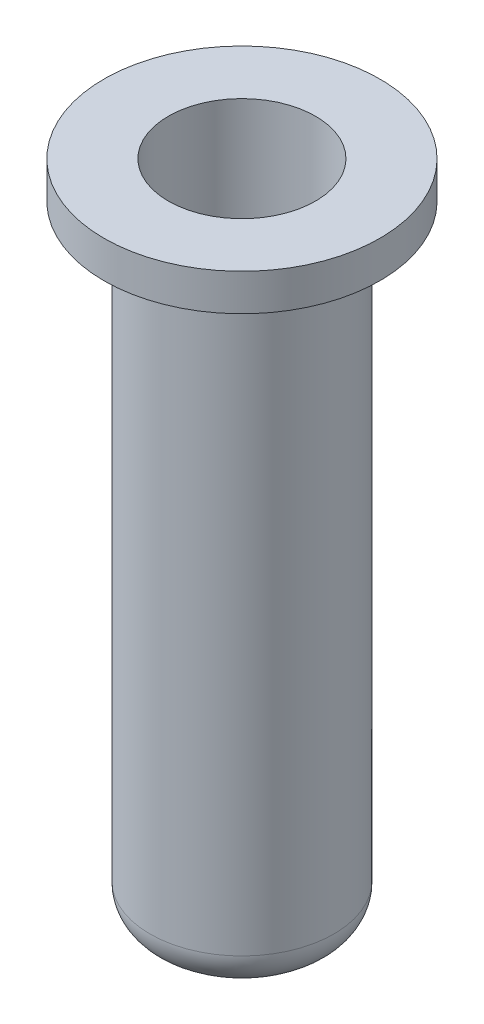
from build123d import *

# Parameters (mm, degrees)
SKETCH2_R                 = 2.5
BOSS_EXTRUDE1_DEPTH       = 18
FILLET3_R                 = 1
BOSS_EXTRUDE2_START       = -1
SKETCH5_R                 = 3.75
SKETCH5_R_2               = 2.5
BOSS_EXTRUDE2_DEPTH       = 1
F_1_0MM_DOWEL_HOLE1_D     = 4
F_1_0MM_DOWEL_HOLE1_DEPTH = 13.785898385
F_1_0MM_DOWEL_HOLE1_TIP   = 3.464101615


with BuildPart() as part:
    # Sketch2 → Boss-Extrude1 (new body)
    with BuildSketch(Plane(origin=(0, 0, 0), x_dir=(1, 0, 0), z_dir=(0, 1, 0))):
        with Locations(Location((0, 0, 0), (0, 0, 270))):
            Circle(SKETCH2_R)
    extrude(amount=BOSS_EXTRUDE1_DEPTH)

    # Fillet3
    fillet3_edges = [part.edges().sort_by_distance(p)[0] for p in [
        (0, 0, -2.5),
    ]]
    fillet(fillet3_edges, radius=FILLET3_R)

    # Sketch5 → Boss-Extrude2 (add)
    with BuildSketch(Plane(origin=(0, 18, 0), x_dir=(1, 0, 0), z_dir=(0, 1, 0)).offset(BOSS_EXTRUDE2_START)):
        with Locations(Location((0, 0, 0), (0, 0, 270))):
            Circle(SKETCH5_R)
        with Locations(Location((0, 0, 0), (0, 0, 270))):
            Circle(SKETCH5_R_2, mode=Mode.SUBTRACT)
    extrude(amount=BOSS_EXTRUDE2_DEPTH)

    # Ø1.0mm Dowel Hole1
    with Locations(Plane(origin=(0, 18, 0), x_dir=(1, 0, 0), z_dir=(0, 1, 0))):
        with Locations((0, 0)):
            Hole(F_1_0MM_DOWEL_HOLE1_D / 2, depth=F_1_0MM_DOWEL_HOLE1_DEPTH)
            with Locations((0, 0, -(F_1_0MM_DOWEL_HOLE1_DEPTH + F_1_0MM_DOWEL_HOLE1_TIP / 2))):  # 60° drill point
                Cone(0, F_1_0MM_DOWEL_HOLE1_D / 2, F_1_0MM_DOWEL_HOLE1_TIP, mode=Mode.SUBTRACT)


solid = part.part
